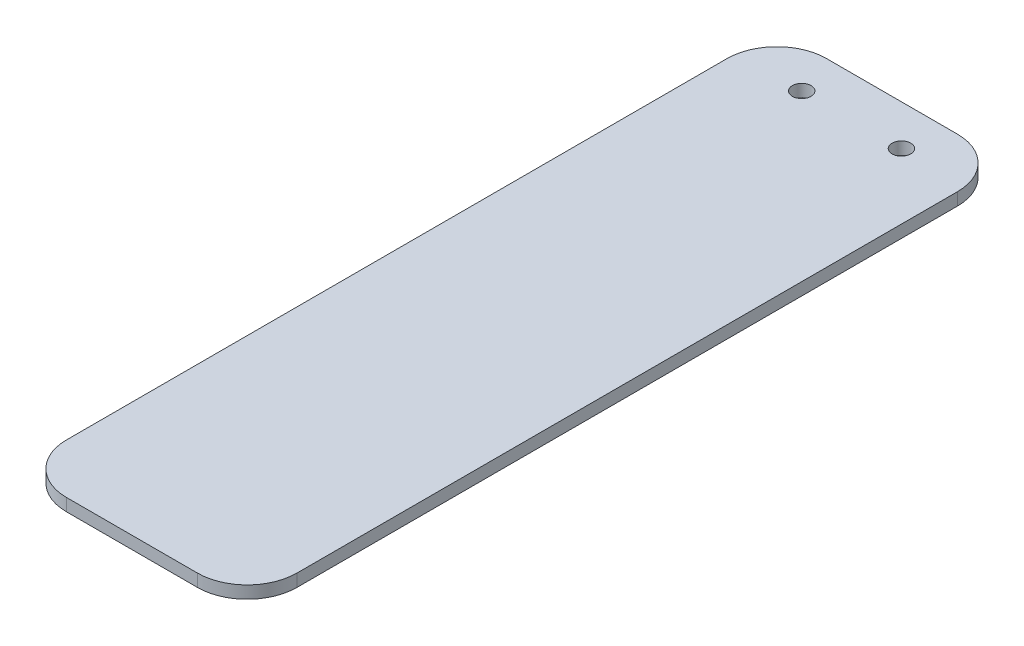
from build123d import *

# Parameters (mm, degrees)
SKETCH1_R           = 1.5
BOSS_EXTRUDE1_DEPTH = 2


with BuildPart() as part:
    # Sketch1 → Boss-Extrude1 (new body)
    with BuildSketch(Plane(origin=(0, 0, 0), x_dir=(1, 0, 0), z_dir=(0, 1, 0))):
        with BuildLine():
            Line((8, 0), (29, 0))
            ThreePointArc((29, 0), (34.656854249, 2.343145751), (37, 8))
            Line((37, 8), (37, 114))
            ThreePointArc((37, 114), (34.656854249, 119.656854249), (29, 122))
            Line((29, 122), (8, 122))
            ThreePointArc((8, 122), (2.343145751, 119.656854249), (0, 114))
            Line((0, 114), (0, 8))
            ThreePointArc((0, 8), (2.343145751, 2.343145751), (8, 0))
        make_face()
        with Locations(Location((26.5, 115.5, 0), (0, 0, 270))):
            Circle(SKETCH1_R, mode=Mode.SUBTRACT)
        with Locations(Location((10.5, 115.5, 0), (0, 0, 90))):
            Circle(SKETCH1_R, mode=Mode.SUBTRACT)
    extrude(amount=BOSS_EXTRUDE1_DEPTH)


solid = part.part
